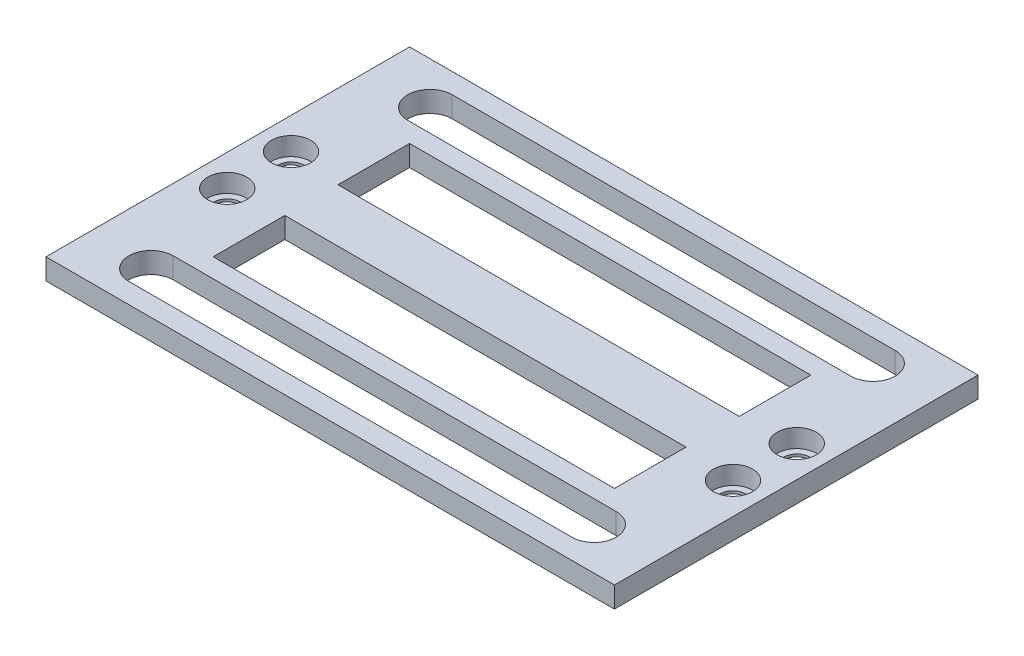
from build123d import *

# Parameters (mm, degrees)
SKETCH1_W               = 54.3999928
SKETCH1_H               = 34.798
SKETCH1_W_2             = 38.3999994
SKETCH1_H_2             = 6.849999
BOSS_EXTRUDE1_DEPTH     = 1.999996
CUT_EXTRUDE1_DEPTH      = 33.350656704
CUT_EXTRUDE1_DEPTH_BACK = 5.5500016
SKETCH2_R               = 1.8750026
BOSS_EXTRUDE2_START     = -0.2500122
SKETCH3_R               = 1.8750026
SKETCH3_R_2             = 1.2499975
BOSS_EXTRUDE2_DEPTH     = 0.2500122


with BuildPart() as part:
    # Sketch1 → Boss-Extrude1 (new body)
    with BuildSketch(Plane(origin=(0, 0, 0), x_dir=(1, 0, 0), z_dir=(0, 1, 0))):
        Rectangle(SKETCH1_W, SKETCH1_H)
        with BuildLine():
            Line((-21.2000084, -11.224006), (21.2000084, -11.224006))
            ThreePointArc((21.2000084, -11.224006), (23.3250105, -13.3490081), (21.2000084, -15.4740102))
            Line((21.2000084, -15.4740102), (-21.2000084, -15.4740102))
            ThreePointArc((-21.2000084, -15.4740102), (-23.3250105, -13.3490081), (-21.2000084, -11.224006))
        make_face(mode=Mode.SUBTRACT)
        with BuildLine():
            Line((-21.2000084, 11.224006), (21.2000084, 11.224006))
            ThreePointArc((21.2000084, 11.224006), (23.3250105, 13.3490081), (21.2000084, 15.4740102))
            Line((21.2000084, 15.4740102), (-21.2000084, 15.4740102))
            ThreePointArc((-21.2000084, 15.4740102), (-23.3250105, 13.3490081), (-21.2000084, 11.224006))
        make_face(mode=Mode.SUBTRACT)
        with Locations((-1.27e-05, 5.9702065)):
            Rectangle(SKETCH1_W_2, SKETCH1_H_2, mode=Mode.SUBTRACT)
        with Locations((-1.27e-05, -5.9702065)):
            Rectangle(SKETCH1_W_2, SKETCH1_H_2, mode=Mode.SUBTRACT)
    extrude(amount=BOSS_EXTRUDE1_DEPTH)

    # Sketch2 → Cut-Extrude1 (cut, two sides: drawn at the far end of the back side and taken through both)
    with BuildSketch(Plane(origin=(0, 1.999996, 0), x_dir=(1, 0, 0), z_dir=(0, 1, 0)).offset(-CUT_EXTRUDE1_DEPTH_BACK)):
        with Locations(Location((-24.2000278, -3.0537912, 0), (0, 0, 90))):
            Circle(SKETCH2_R)
        with Locations(Location((-24.2000278, 3.0537912, 0), (0, 0, 90))):
            Circle(SKETCH2_R)
        with Locations(Location((24.2000278, 3.0537912, 0), (0, 0, 90))):
            Circle(SKETCH2_R)
        with Locations(Location((24.2000278, -3.0537912, 0), (0, 0, 90))):
            Circle(SKETCH2_R)
    extrude(amount=CUT_EXTRUDE1_DEPTH + CUT_EXTRUDE1_DEPTH_BACK, mode=Mode.SUBTRACT)

    # Sketch3 → Boss-Extrude2 (add)
    # profile 1 of 4: a face of its own
    with BuildSketch(Plane.XZ.offset(BOSS_EXTRUDE2_START)):
        with Locations(Location((-24.2000278, 3.0537912, 0), (0, 0, 270))):
            Circle(SKETCH3_R)
        with Locations(Location((-24.2000278, 3.0537912, 0), (0, 0, 90))):
            Circle(SKETCH3_R_2, mode=Mode.SUBTRACT)
    # profile 2 of 4: a face of its own
    with BuildSketch(Plane.XZ.offset(BOSS_EXTRUDE2_START)):
        with Locations(Location((-24.2000278, -3.0537912, 0), (0, 0, 270))):
            Circle(SKETCH3_R)
        with Locations(Location((-24.2000278, -3.0537912, 0), (0, 0, 270))):
            Circle(SKETCH3_R_2, mode=Mode.SUBTRACT)
    # profile 3 of 4: a face of its own
    with BuildSketch(Plane.XZ.offset(BOSS_EXTRUDE2_START)):
        with Locations(Location((24.2000278, -3.0537912, 0), (0, 0, 270))):
            Circle(SKETCH3_R)
        with Locations(Location((24.2000278, -3.0537912, 0), (0, 0, 90))):
            Circle(SKETCH3_R_2, mode=Mode.SUBTRACT)
    # profile 4 of 4: a face of its own
    with BuildSketch(Plane.XZ.offset(BOSS_EXTRUDE2_START)):
        with Locations(Location((24.2000278, 3.0537912, 0), (0, 0, 270))):
            Circle(SKETCH3_R)
        with Locations(Location((24.2000278, 3.0537912, 0), (0, 0, 270))):
            Circle(SKETCH3_R_2, mode=Mode.SUBTRACT)
    extrude(amount=BOSS_EXTRUDE2_DEPTH)


solid = part.part
